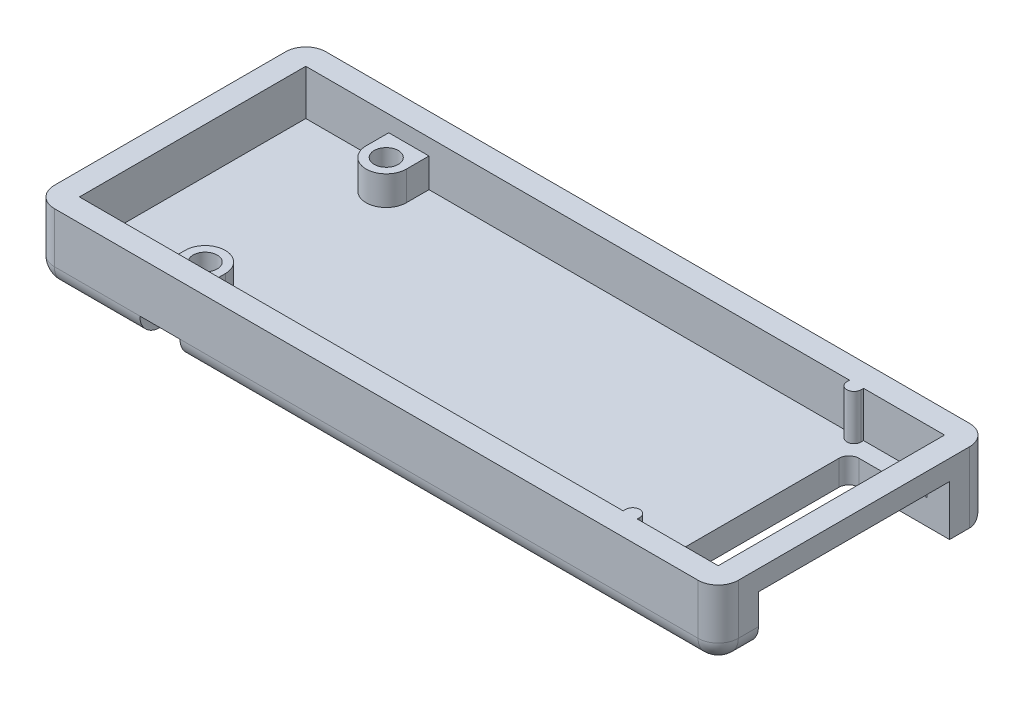
from build123d import *

# Parameters (mm, degrees)
SKETCH_1_W          = 68
SKETCH_1_H          = 27
EXTRUDE_1_DEPTH     = 7
SKETCH_2_W          = 63.5
SKETCH_2_H          = 22.5
CUT_EXTRUDE_1_DEPTH = 4.5
EXTRUDE_2_DEPTH     = 2.9
EXTRUDE_3_DEPTH     = 4.5
SKETCH_5_R          = 1.2
CUT_EXTRUDE_2_DEPTH = 37.978507271
CUT_EXTRUDE_3_DEPTH = 2
SKETCH_7_W          = 10
SKETCH_7_H          = 19
CUT_EXTRUDE_4_DEPTH = 5
FILLET_1_R          = 2
FILLET_2_R          = 1


with BuildPart() as part:
    # Эскиз1 → Бобышка-Вытянуть1 (new body)
    with BuildSketch(Plane(origin=(0, 0, 0), x_dir=(1, 0, 0), z_dir=(0, 1, 0))):
        Rectangle(SKETCH_1_W, SKETCH_1_H)
    extrude(amount=EXTRUDE_1_DEPTH)

    # Эскиз2 → Вырез-Вытянуть1 (cut)
    with BuildSketch(Plane(origin=(0, 7, 0), x_dir=(1, 0, 0), z_dir=(0, 1, 0))):
        Rectangle(SKETCH_2_W, SKETCH_2_H)
    extrude(amount=-CUT_EXTRUDE_1_DEPTH, mode=Mode.SUBTRACT)

    # Эскиз3 → Бобышка-Вытянуть2 (add)
    with BuildSketch(Plane(origin=(0, 2.5, 0), x_dir=(1, 0, 0), z_dir=(0, 1, 0))):
        with BuildLine():
            Line((-23.5, 9), (-23.5, 11.25))
            Line((-23.5, 11.25), (-19.5, 11.25))
            Line((-19.5, 11.25), (-19.5, 9))
            ThreePointArc((-19.5, 9), (-21.5, 7), (-23.5, 9))
        make_face()
        with BuildLine():
            Line((-19.5, -11.25), (-19.5, -9))
            ThreePointArc((-19.5, -9), (-21.5, -7), (-23.5, -9))
            Line((-23.5, -9), (-23.5, -11.25))
            Line((-23.5, -11.25), (-19.5, -11.25))
        make_face()
    extrude(amount=EXTRUDE_2_DEPTH)

    # Эскиз4 → Бобышка-Вытянуть3 (add)
    with BuildSketch(Plane(origin=(0, 2.5, 0), x_dir=(1, 0, 0), z_dir=(0, 1, 0))):
        with BuildLine():
            Line((22.3, 11), (22.3, 11.25))
            Line((22.3, 11.25), (23.7, 11.25))
            Line((23.7, 11.25), (23.7, 11))
            ThreePointArc((23.7, 11), (23, 10.3), (22.3, 11))
        make_face()
        with BuildLine():
            Line((23.7, -11.25), (23.7, -11))
            ThreePointArc((23.7, -11), (23, -10.3), (22.3, -11))
            Line((22.3, -11), (22.3, -11.25))
            Line((22.3, -11.25), (23.7, -11.25))
        make_face()
    extrude(amount=EXTRUDE_3_DEPTH)

    # Эскиз5 → Вырез-Вытянуть2 (cut, through all)
    with BuildSketch(Plane(origin=(0, 5.4, 0), x_dir=(1, 0, 0), z_dir=(0, 1, 0))):
        with Locations(Location((-21.5, 9, 0), (0, 0, 270))):
            Circle(SKETCH_5_R)
        with Locations(Location((-21.5, -9, 0), (0, 0, 270))):
            Circle(SKETCH_5_R)
    extrude(amount=-CUT_EXTRUDE_2_DEPTH, mode=Mode.SUBTRACT)

    # Эскиз6 → Вырез-Вытянуть3 (cut)
    with BuildSketch(Plane.XZ):
        with BuildLine():
            Line((-19.5, -9), (-19.5, -13.5))
            Line((-19.5, -13.5), (-23.5, -13.5))
            Line((-23.5, -13.5), (-23.5, -9))
            ThreePointArc((-23.5, -9), (-21.5, -7), (-19.5, -9))
        make_face()
        with BuildLine():
            Line((-23.5, 13.5), (-23.5, 9))
            ThreePointArc((-23.5, 9), (-21.5, 7), (-19.5, 9))
            Line((-19.5, 9), (-19.5, 13.5))
            Line((-19.5, 13.5), (-23.5, 13.5))
        make_face()
    extrude(amount=-CUT_EXTRUDE_3_DEPTH, mode=Mode.SUBTRACT)

    # Эскиз7 → Вырез-Вытянуть4 (cut)
    with BuildSketch(Plane.XZ):
        with Locations((29, 0)):
            Rectangle(SKETCH_7_W, SKETCH_7_H)
    extrude(amount=-CUT_EXTRUDE_4_DEPTH, mode=Mode.SUBTRACT)

    # Скругление1
    fillet_1_edges = [part.edges().sort_by_distance(p)[0] for p in [
        (-28.75, 0, -13.5),
        (7.25, 0, -13.5),
        (34, 3.5, -13.5),
        (-34, 3.5, -13.5),
        (-28.75, 0, 13.5),
        (7.25, 0, 13.5),
        (34, 0, 11.5),
        (-34, 0, 0),
        (34, 3.5, 13.5),
        (-34, 3.5, 13.5),
    ]]
    fillet(fillet_1_edges, radius=FILLET_1_R)

    # Скругление2
    fillet_2_edges = [part.edges().sort_by_distance(p)[0] for p in [
        (24, 1.25, -9.5),
        (24, 1.25, 9.5),
    ]]
    fillet(fillet_2_edges, radius=FILLET_2_R)


solid = part.part
